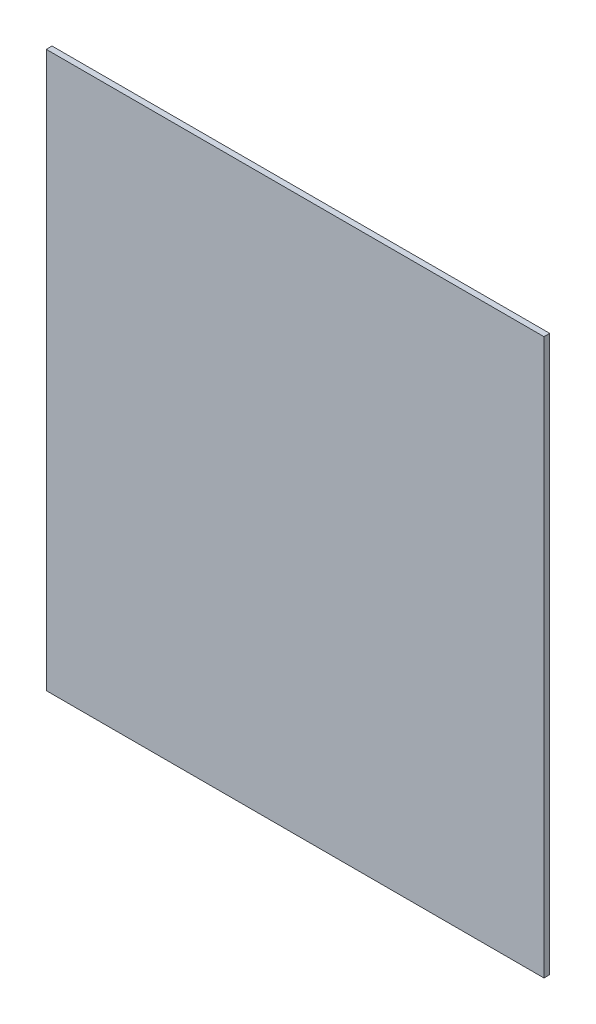
from build123d import *

# Parameters (mm, degrees)
ESBO_O1_W                = 69
ESBO_O1_H                = 77
RESSALTO_EXTRUS_O1_DEPTH = 0.8


with BuildPart() as part:
    # Esboço1 → Ressalto-extrusão1 (new body)
    with BuildSketch(Plane.XY):
        Rectangle(ESBO_O1_W, ESBO_O1_H)
    extrude(amount=RESSALTO_EXTRUS_O1_DEPTH)


solid = part.part
